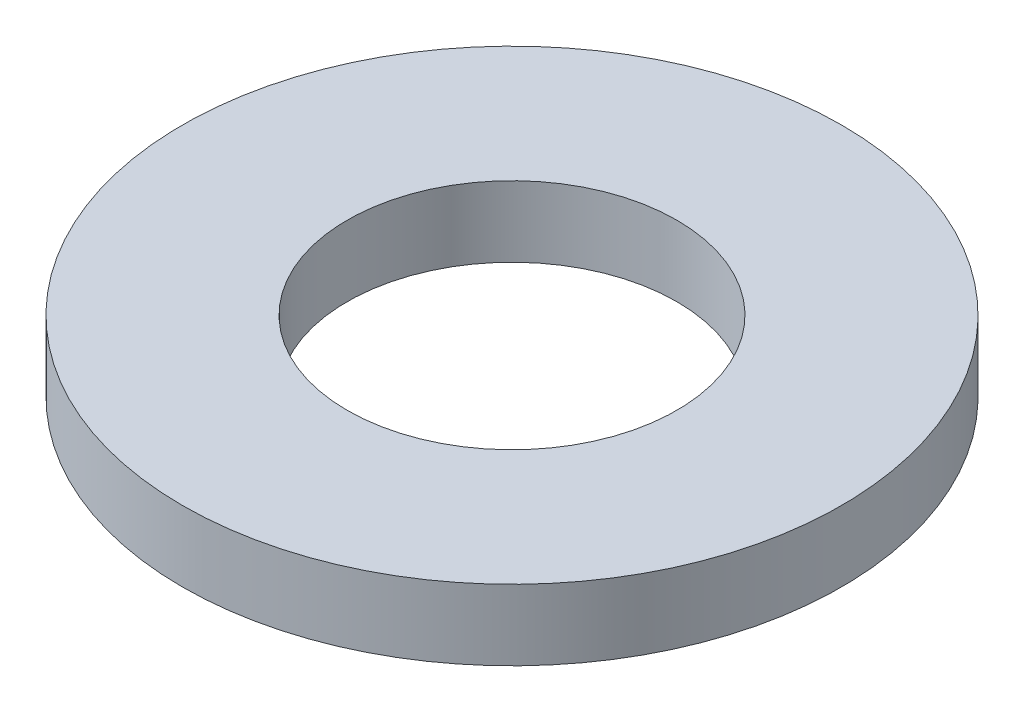
from build123d import *

# Parameters (mm, degrees)
SKETCH1_R           = 14
SKETCH1_R_2         = 7
BOSS_EXTRUDE1_DEPTH = 1.5


with BuildPart() as part:
    # Sketch1 → Boss-Extrude1 (new, symmetric)
    with BuildSketch(Plane(origin=(0, 0, 0), x_dir=(1, 0, 0), z_dir=(0, 1, 0))):
        with Locations(Location((0, 0, 0), (0, 0, 270))):
            Circle(SKETCH1_R)
        with Locations(Location((0, 0, 0), (0, 0, 270))):
            Circle(SKETCH1_R_2, mode=Mode.SUBTRACT)
    extrude(amount=BOSS_EXTRUDE1_DEPTH, both=True)


solid = part.part
